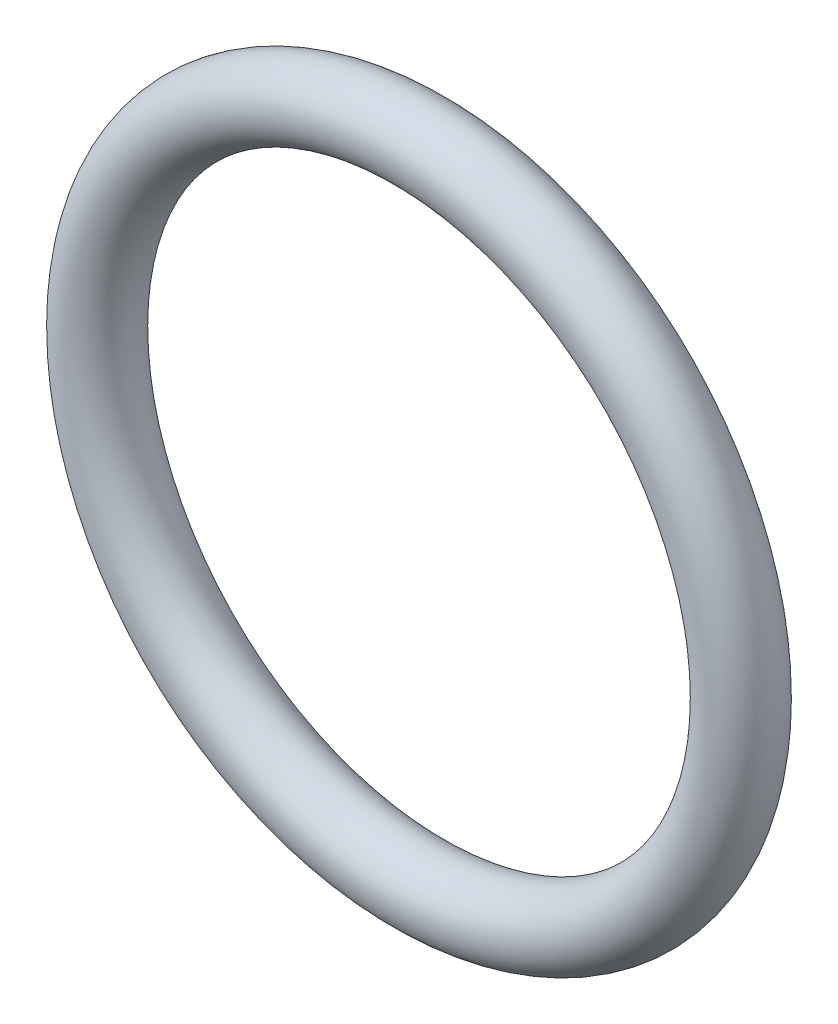
from build123d import *

# Parameters (mm, degrees)
SKETCH1_R = 1.75


with BuildPart() as part:
    # Sketch1 → Revolve1 (revolve)
    with BuildSketch(Plane(origin=(0, 0, 0), x_dir=(0, -1, 0), z_dir=(1, 0, 0)), mode=Mode.PRIVATE) as revolve1_sk:
        with Locations((15.75, 0)):
            Circle(SKETCH1_R)
    revolve(revolve1_sk.sketch.rotate(Axis((0, 0, 1.75), (0, 0, -1)), 270), axis=Axis((0, 0, 1.75), (0, 0, -1)))


solid = part.part
